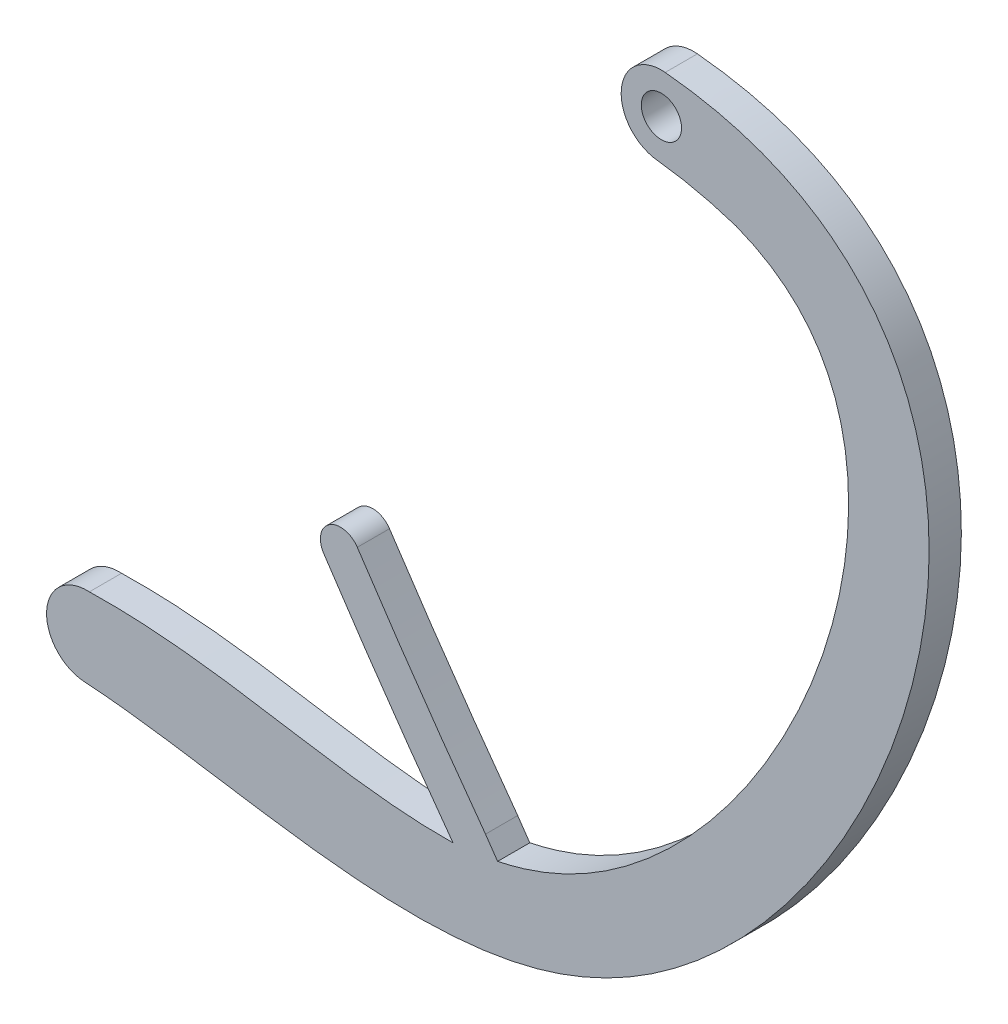
from build123d import *

# Parameters (mm, degrees)
BOSS_EXTRUDE1_DEPTH = 2.54
CUT_EXTRUDE1_REACH  = 85.854
SKETCH3_R           = 1.5875


with BuildPart() as part:
    # Sketch1 → Boss-Extrude1 (new body)
    with BuildSketch(Plane.XY):
        with BuildLine():
            ThreePointArc((-34.83986326, -65.324552852), (-38.2071347, -68.294861429), (-35.236826123, -71.66213287))
            add(Edge.make_bspline(
                [(10.586372466, -7.126145507), (11.002525682, -7.165560423), (11.842009581, -7.259594031), (13.445793666, -7.497821941), (15.358508428, -7.892790201), (17.493715434, -8.516327348), (20.134435017, -9.541319585), (23.047894952, -11.172937086), (25.921475474, -13.638972903), (28.170317734, -16.539917581), (30.356639499, -20.877284542), (31.65118113, -26.978157887), (31.240937045, -34.908794595), (29.156003941, -43.069094129), (25.635995414, -51.07625165), (20.90067039, -58.538840574), (15.150976409, -65.0507057), (8.587997117, -70.214219903), (1.335167823, -73.532497291), (-6.197343227, -74.730184138), (-13.766967954, -74.543564506), (-19.99707814, -73.723544541), (-24.863533758, -72.962255978), (-28.436362961, -72.408085673), (-31.328557034, -72.018315593), (-33.588022169, -71.782799811), (-34.683820018, -71.696771152), (-35.236826123, -71.66213287)],
                knots=[0, 0, 0, 0, 0.0078125, 0.015625, 0.03125, 0.046875, 0.0625, 0.09375, 0.125, 0.15625, 0.1875, 0.25, 0.3125, 0.375, 0.4375, 0.5, 0.5625, 0.625, 0.6875, 0.75, 0.8125, 0.875, 0.90625, 0.9375, 0.96875, 0.984375, 1, 1, 1, 1], degree=3))
            ThreePointArc((10.586372466, -7.126145507), (7.126145507, -9.987627534), (9.987627534, -13.447854493))
            add(Edge.make_bspline(
                [(16.185687447, -14.828634458), (13.159279331, -13.818364694), (9.987627534, -13.447854493)],
                knots=[0, 0, 0, 1, 1, 1], degree=2))
            add(Edge.make_bspline(
                [(16.185687447, -14.828634458), (16.626552591, -14.999751236), (17.516256805, -15.389362386), (19.048590925, -16.233671216), (20.665851366, -17.447101789), (22.192245289, -19.130255303), (23.78737336, -21.720766981), (25.019404327, -25.697186568), (25.187096787, -31.56718704), (23.997883937, -38.111286688), (20.745345962, -47.132853017), (15.329747873, -55.703582215), (8.621815884, -62.281522038), (4.20572917, -65.207038027), (0.573138185, -66.788444018), (-1.381931567, -67.361931374), (-2.474374912, -67.600151096), (-2.633155696, -67.633149977)],
                knots=[0.054733487, 0.054733487, 0.054733487, 0.054733487, 0.069503276, 0.084273066, 0.113812644, 0.143352223, 0.172891801, 0.231970958, 0.291050115, 0.350129272, 0.409208429, 0.527366744, 0.586445901, 0.645525058, 0.675064636, 0.704604215, 0.709598679, 0.709598679, 0.709598679, 0.709598679], degree=3))
            Line((-2.633155696, -67.633149977), (-3.589318796, -66.250016051))
            add(Edge.make_bspline(
                [(-3.589318796, -66.250016051), (-7.081368607, -61.490752258), (-10.454154618, -56.641640427), (-13.701165647, -51.711942352)],
                knots=[0, 0, 0, 0, 1, 1, 1, 1], degree=3))
            ThreePointArc((-13.701165647, -51.711942352), (-15.900149416, -51.259412923), (-16.352678845, -53.458396692))
            add(Edge.make_bspline(
                [(-6.149161319, -68.128268232), (-9.674217346, -63.32402075), (-13.075389854, -58.43406357), (-16.352678845, -53.458396692)],
                knots=[0, 0, 0, 0, 1, 1, 1, 1], degree=3))
            add(Edge.make_bspline(
                [(-6.149161319, -68.128268232), (-11.754405025, -68.216156013), (-21.178886313, -66.241491877), (-30.778963239, -65.215205279), (-34.83986326, -65.324552852)],
                knots=[0, 0, 0, 0, 0.578093232, 1, 1, 1, 1], degree=3))
        make_face()
    extrude(amount=BOSS_EXTRUDE1_DEPTH)

    # Sketch3 → Cut-Extrude1 (cut, up to next)
    with BuildSketch(Plane(origin=(0, 0, 0), x_dir=(-1, 0, 0), z_dir=(0, 0, -1)), mode=Mode.PRIVATE) as cut_extrude1_sk1:
        with Locations((-10.287, -10.287)):
            Circle(SKETCH3_R)
    cut_extrude1_tool1 = extrude(cut_extrude1_sk1.sketch, amount=-CUT_EXTRUDE1_REACH, mode=Mode.PRIVATE) & part.part
    add(cut_extrude1_tool1.solids().sort_by_distance((10.287, -10.287, 0))[0], mode=Mode.SUBTRACT)


solid = part.part
